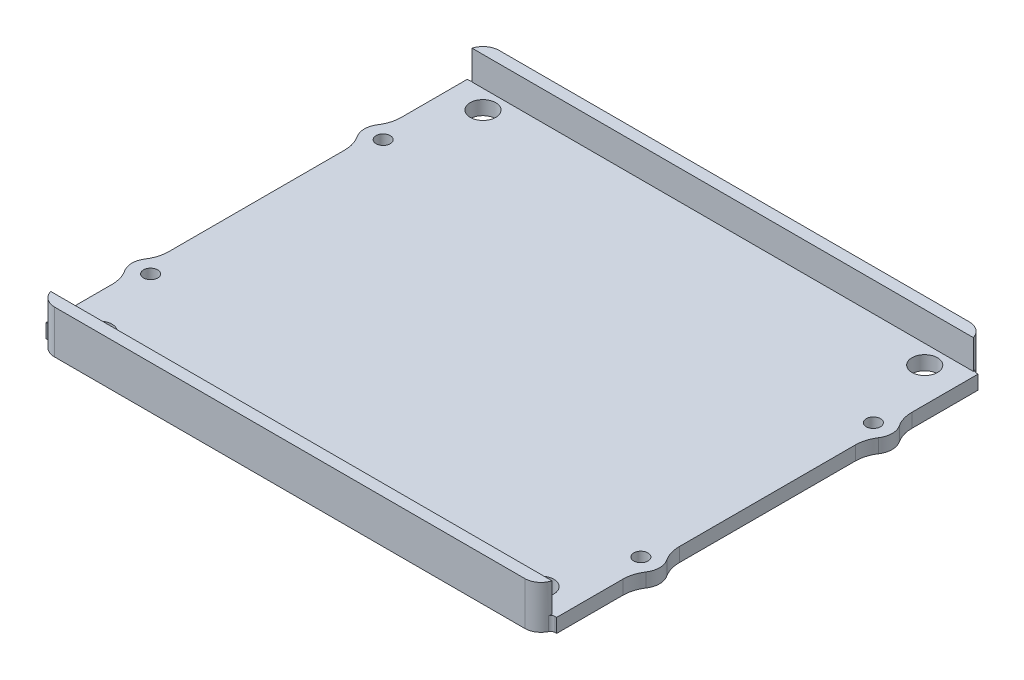
from build123d import *

# Parameters (mm, degrees)
BOSS_EXTRUDE1_DEPTH   = 7.8
BOSS_EXTRUDE1_2_DEPTH = 7.8
BOSS_EXTRUDE2_DEPTH   = 1.5
SKETCH5_R             = 1.6
CUT_EXTRUDE1_DEPTH    = 74.072152553
SKETCH6_R             = 1.525
CUT_EXTRUDE2_DEPTH    = 74.072152553
SKETCH7_R             = 4.025
SKETCH7_R_2           = 1.525
BOSS_EXTRUDE3_DEPTH   = 1.5
FILLET1_R             = 7
SKETCH8_R             = 2.75
CUT_EXTRUDE3_DEPTH    = 3


with BuildPart() as part:
    # Sketch1 → Boss-Extrude1 (new body)
    with BuildSketch(Plane(origin=(0, 0, 0), x_dir=(1, 0, 0), z_dir=(0, 1, 0))):
        with BuildLine():
            Line((-50.55, -45.3), (50.55, -45.3))
            Line((50.55, -45.3), (53.904101966, -45.3))
            ThreePointArc((53.904101966, -45.3), (52.641650066, -47.10624304), (50.55, -47.8))
            Line((50.55, -47.8), (-50.55, -47.8))
            ThreePointArc((-50.55, -47.8), (-52.641650066, -47.10624304), (-53.904101966, -45.3))
            Line((-53.904101966, -45.3), (-50.55, -45.3))
        make_face()
    extrude(amount=BOSS_EXTRUDE1_DEPTH)



with BuildPart() as body_2:
    # Sketch1 → Boss-Extrude1 2 (new body)
    with BuildSketch(Plane(origin=(0, 0, 0), x_dir=(1, 0, 0), z_dir=(0, 1, 0))):
        with BuildLine():
            Line((-50.55, 45.3), (50.55, 45.3))
            Line((50.55, 45.3), (53.904101966, 45.3))
            ThreePointArc((53.904101966, 45.3), (52.641650066, 47.10624304), (50.55, 47.8))
            Line((50.55, 47.8), (-50.55, 47.8))
            ThreePointArc((-50.55, 47.8), (-52.641650066, 47.10624304), (-53.904101966, 45.3))
            Line((-53.904101966, 45.3), (-50.55, 45.3))
        make_face()
    extrude(amount=BOSS_EXTRUDE1_2_DEPTH)


with BuildPart() as part_1:
    add(part.part)

    add(body_2.part)  # Boss-Extrude2 merges body 2
    # Sketch3 → Boss-Extrude2 (add, symmetric)
    with BuildSketch(Plane(origin=(0, 0, 0), x_dir=(1, 0, 0), z_dir=(0, 1, 0))):
        with BuildLine():
            Line((-50.55, 47.8), (50.55, 47.8))
            ThreePointArc((50.55, 47.8), (52.394661968, 47.27442805), (53.685322458, 45.855555556))
            ThreePointArc((53.685322458, 45.855555556), (54.054082597, 45.450163414), (54.581128874, 45.3))
            Line((54.581128874, 45.3), (54.909101966, 45.3))
            Line((54.909101966, 45.3), (54.909101966, -45.3))
            Line((54.909101966, -45.3), (54.581128874, -45.3))
            ThreePointArc((54.581128874, -45.3), (54.054082597, -45.450163414), (53.685322458, -45.855555556))
            ThreePointArc((53.685322458, -45.855555556), (52.394661968, -47.27442805), (50.55, -47.8))
            Line((50.55, -47.8), (-50.55, -47.8))
            ThreePointArc((-50.55, -47.8), (-52.394661968, -47.27442805), (-53.685322458, -45.855555556))
            ThreePointArc((-53.685322458, -45.855555556), (-54.054082597, -45.450163414), (-54.581128874, -45.3))
            Line((-54.581128874, -45.3), (-54.909101966, -45.3))
            Line((-54.909101966, -45.3), (-54.909101966, 45.3))
            Line((-54.909101966, 45.3), (-54.581128874, 45.3))
            ThreePointArc((-54.581128874, 45.3), (-54.054082597, 45.450163414), (-53.685322458, 45.855555556))
            ThreePointArc((-53.685322458, 45.855555556), (-52.394661968, 47.27442805), (-50.55, 47.8))
        make_face()
    extrude(amount=BOSS_EXTRUDE2_DEPTH, both=True)

    # Sketch5 → Cut-Extrude1 (cut, through all)
    with BuildSketch(Plane(origin=(0, 1.5, 0), x_dir=(1, 0, 0), z_dir=(0, 1, 0))):
        with Locations(Location((-47.5, 41.25, 0), (0, 0, 270))):
            Circle(SKETCH5_R)
        with Locations(Location((47.5, 41.25, 0), (0, 0, 90))):
            Circle(SKETCH5_R)
        with Locations(Location((47.5, -41.25, 0), (0, 0, 270))):
            Circle(SKETCH5_R)
        with Locations(Location((-47.5, -41.25, 0), (0, 0, 90))):
            Circle(SKETCH5_R)
    extrude(amount=-CUT_EXTRUDE1_DEPTH, mode=Mode.SUBTRACT)

    # Sketch6 → Cut-Extrude2 (cut, through all)
    with BuildSketch(Plane(origin=(0, 1.5, 0), x_dir=(1, 0, 0), z_dir=(0, 1, 0))):
        with Locations(Location((-52.709101966, 25, 0), (0, 0, 270))):
            Circle(SKETCH6_R)
        with Locations(Location((52.709101966, 25, 0), (0, 0, 90))):
            Circle(SKETCH6_R)
        with Locations(Location((52.709101966, -25, 0), (0, 0, 270))):
            Circle(SKETCH6_R)
        with Locations(Location((-52.709101966, -25, 0), (0, 0, 90))):
            Circle(SKETCH6_R)
    extrude(amount=-CUT_EXTRUDE2_DEPTH, mode=Mode.SUBTRACT)

    # Sketch7 → Boss-Extrude3 (add, symmetric)
    # profile 1 of 4: a face of its own
    with BuildSketch(Plane(origin=(0, 0, 0), x_dir=(1, 0, 0), z_dir=(0, 1, 0))):
        with Locations((-52.709101966, 25)):
            Circle(SKETCH7_R)
        with Locations(Location((-52.709101966, 25, 0), (0, 0, 270))):
            Circle(SKETCH7_R_2, mode=Mode.SUBTRACT)
    # profile 2 of 4: a face of its own
    with BuildSketch(Plane(origin=(0, 0, 0), x_dir=(1, 0, 0), z_dir=(0, 1, 0))):
        with Locations((-52.709101966, -25)):
            Circle(SKETCH7_R)
        with Locations(Location((-52.709101966, -25, 0), (0, 0, 90))):
            Circle(SKETCH7_R_2, mode=Mode.SUBTRACT)
    # profile 3 of 4: a face of its own
    with BuildSketch(Plane(origin=(0, 0, 0), x_dir=(1, 0, 0), z_dir=(0, 1, 0))):
        with Locations((52.709101966, 25)):
            Circle(SKETCH7_R)
        with Locations(Location((52.709101966, 25, 0), (0, 0, 90))):
            Circle(SKETCH7_R_2, mode=Mode.SUBTRACT)
    # profile 4 of 4: a face of its own
    with BuildSketch(Plane(origin=(0, 0, 0), x_dir=(1, 0, 0), z_dir=(0, 1, 0))):
        with Locations((52.709101966, -25)):
            Circle(SKETCH7_R)
        with Locations(Location((52.709101966, -25, 0), (0, 0, 270))):
            Circle(SKETCH7_R_2, mode=Mode.SUBTRACT)
    extrude(amount=BOSS_EXTRUDE3_DEPTH, both=True)

    # Fillet1
    fillet1_edges = [part_1.edges().sort_by_distance(p)[0] for p in [
        (-54.909101966, 0, 28.370552625),
        (-54.909101966, 0, 21.629447375),
        (54.909101966, 0, -28.370552625),
        (54.909101966, 0, -21.629447375),
        (54.909101966, 0, 21.629447375),
        (54.909101966, 0, 28.370552625),
        (-54.909101966, 0, -21.629447375),
        (-54.909101966, 0, -28.370552625),
    ]]
    fillet(fillet1_edges, radius=FILLET1_R)

    # Sketch8 → Cut-Extrude3 (cut)
    with BuildSketch(Plane(origin=(0, 1.5, 0), x_dir=(1, 0, 0), z_dir=(0, 1, 0))):
        with Locations(Location((-47.5, -41.25, 0), (0, 0, 270))):
            Circle(SKETCH8_R)
        with Locations(Location((-47.5, 41.25, 0), (0, 0, 90))):
            Circle(SKETCH8_R)
        with Locations(Location((47.5, 41.25, 0), (0, 0, 270))):
            Circle(SKETCH8_R)
        with Locations(Location((47.5, -41.25, 0), (0, 0, 90))):
            Circle(SKETCH8_R)
    extrude(amount=-CUT_EXTRUDE3_DEPTH, mode=Mode.SUBTRACT)


solid = part_1.part
